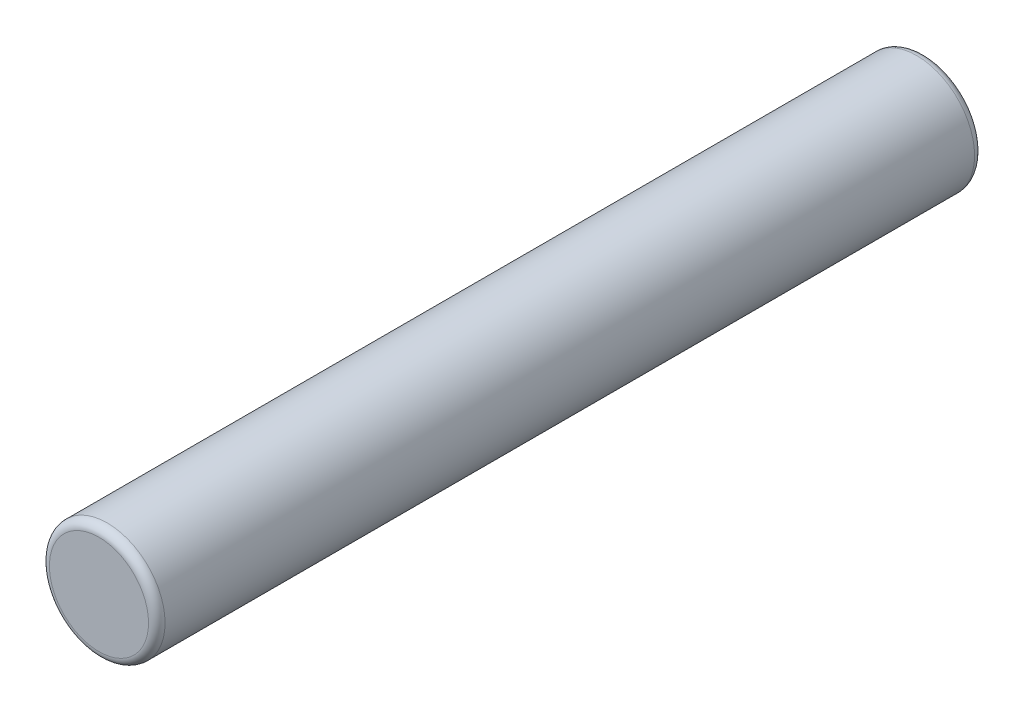
from build123d import *

# Parameters (mm, degrees)
SKETCH2_R           = 5.55625
BOSS_EXTRUDE1_DEPTH = 39.6875
FILLET1_R           = 0.79375


with BuildPart() as part:
    # Sketch2 → Boss-Extrude1 (new, symmetric)
    with BuildSketch(Plane.XY):
        with Locations(Location((0, 0, 0), (0, 0, 180))):
            Circle(SKETCH2_R)
    extrude(amount=BOSS_EXTRUDE1_DEPTH, both=True)

    # Fillet1
    fillet1_edges = [part.edges().sort_by_distance(p)[0] for p in [
        (5.55625, 0, -39.6875),
        (5.55625, 0, 39.6875),
    ]]
    fillet(fillet1_edges, radius=FILLET1_R)


solid = part.part
